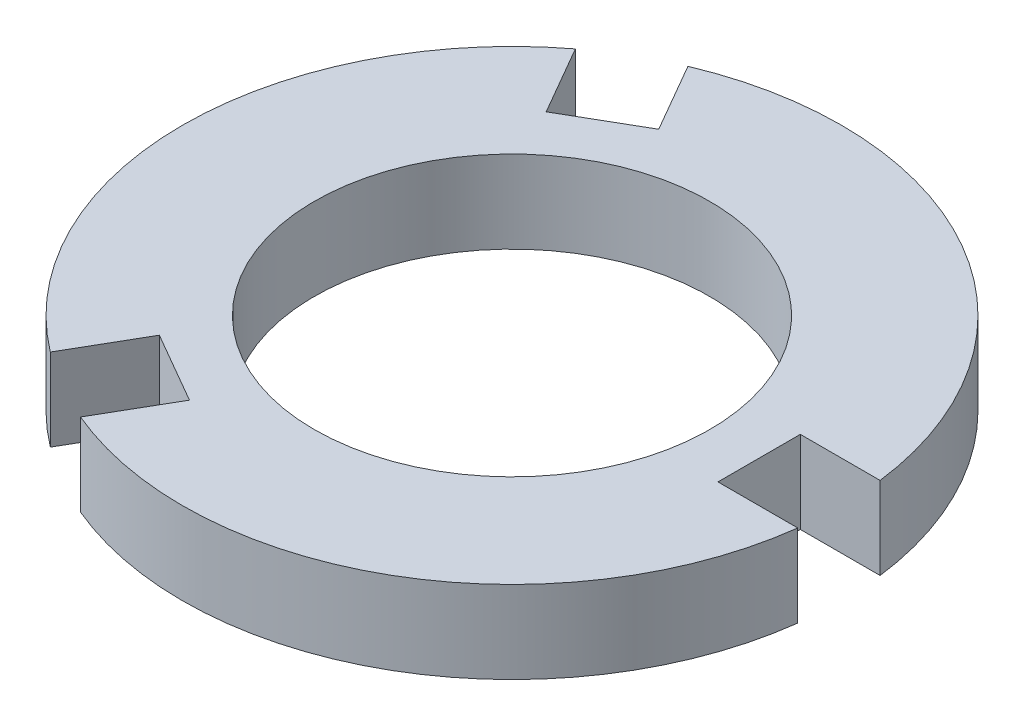
from build123d import *

# Parameters (mm, degrees)
SKETCH1_R           = 100
SKETCH1_R_2         = 60
BOSS_EXTRUDE1_DEPTH = 25
SKETCH2_W           = 25
SKETCH2_H           = 25
CUT_EXTRUDE1_DEPTH  = 144.614066163
CIRPATTERN1_COUNT   = 3


with BuildPart() as part:
    # Sketch1 → Boss-Extrude1 (new body)
    with BuildSketch(Plane(origin=(0, 0, 0), x_dir=(1, 0, 0), z_dir=(0, 1, 0))):
        Circle(SKETCH1_R)
        Circle(SKETCH1_R_2, mode=Mode.SUBTRACT)
    extrude(amount=BOSS_EXTRUDE1_DEPTH)

    # Sketch2 → Cut-Extrude1 (cut, through all)
    with BuildSketch(Plane(origin=(0, 25, 0), x_dir=(1, 0, 0), z_dir=(0, 1, 0))):
        with Locations((87.5, 0)):
            Rectangle(SKETCH2_W, SKETCH2_H)
    cut_extrude1 = extrude(amount=-CUT_EXTRUDE1_DEPTH, mode=Mode.SUBTRACT)

    # CirPattern1: Cut-Extrude1 ×3 about axis
    cirpattern1_axis = Axis((0, 0, 0), (0, 1, 0))
    for i in range(1, CIRPATTERN1_COUNT):
        add(cut_extrude1.rotate(cirpattern1_axis, i * 360 / CIRPATTERN1_COUNT), mode=Mode.SUBTRACT)


solid = part.part
